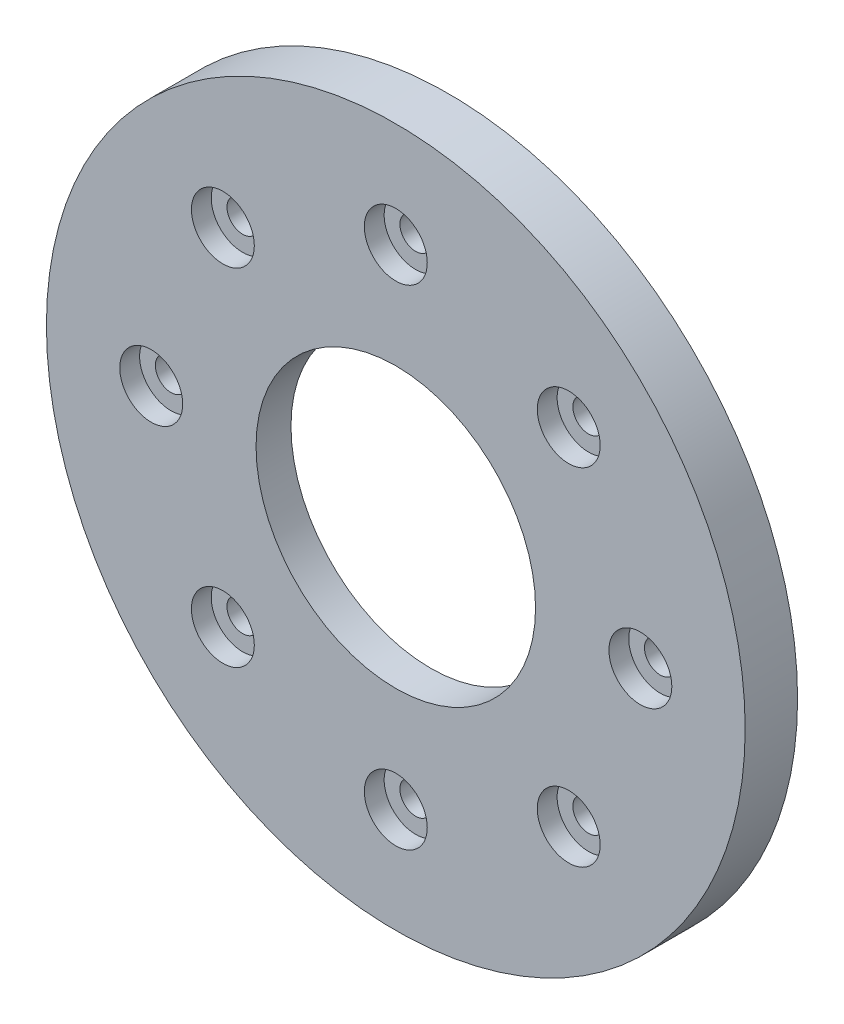
from build123d import *

# Parameters (mm, degrees)
SKETCH1_R                               = 100
SKETCH1_R_2                             = 40
BOSS_EXTRUDE1_DEPTH                     = 15
CBORE_FOR_M8_HEX_HEAD_BOLT1_D           = 9
CBORE_FOR_M8_HEX_HEAD_BOLT1_CBORE_D     = 18.01
CBORE_FOR_M8_HEX_HEAD_BOLT1_CBORE_DEPTH = 5.68
CIRPATTERN1_COUNT                       = 8
SKETCH5_R                               = 82.5
CUT_EXTRUDE2_DEPTH                      = 5


with BuildPart() as part:
    # Sketch1 → Boss-Extrude1 (new body)
    with BuildSketch(Plane.XY):
        Circle(SKETCH1_R)
        Circle(SKETCH1_R_2, mode=Mode.SUBTRACT)
    extrude(amount=BOSS_EXTRUDE1_DEPTH)

    # CBORE for M8 Hex Head Bolt1 (through all)
    with Locations(Plane.XY.offset(15)):
        with Locations((0, 70)):
            cbore_for_m8_hex_head_bolt1 = CounterBoreHole(CBORE_FOR_M8_HEX_HEAD_BOLT1_D / 2, CBORE_FOR_M8_HEX_HEAD_BOLT1_CBORE_D / 2, CBORE_FOR_M8_HEX_HEAD_BOLT1_CBORE_DEPTH)

    # CirPattern1: CBORE for M8 Hex Head Bolt1 ×8 about axis
    cirpattern1_axis = Axis((0, 0, 0), (0, 0, 1))
    for i in range(1, CIRPATTERN1_COUNT):
        add(cbore_for_m8_hex_head_bolt1.rotate(cirpattern1_axis, i * 360 / CIRPATTERN1_COUNT), mode=Mode.SUBTRACT)

    # Sketch5 → Cut-Extrude2 (cut)
    with BuildSketch(Plane(origin=(0, 0, 0), x_dir=(-1, 0, 0), z_dir=(0, 0, -1))):
        Circle(SKETCH5_R)
    extrude(amount=-CUT_EXTRUDE2_DEPTH, mode=Mode.SUBTRACT)


solid = part.part
